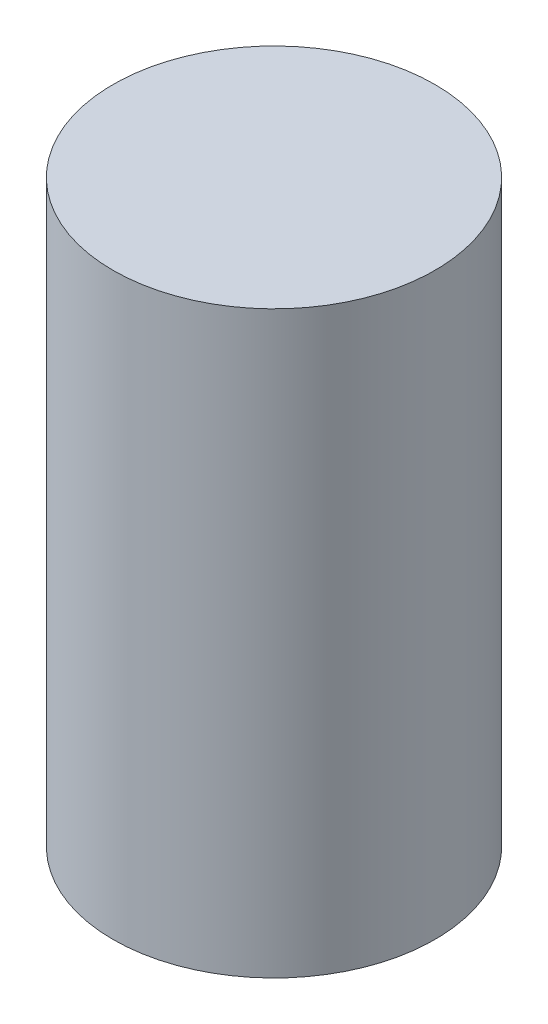
from build123d import *

# Parameters (mm, degrees)
SKETCH_1_R      = 15
EXTRUDE_1_DEPTH = 54


with BuildPart() as part:
    # 草图1 → 凸台-拉伸1 (new body)
    with BuildSketch(Plane(origin=(0, 0, 0), x_dir=(1, 0, 0), z_dir=(0, 1, 0))):
        with Locations(Location((0, 0, 0), (0, 0, 270))):
            Circle(SKETCH_1_R)
    extrude(amount=EXTRUDE_1_DEPTH)


solid = part.part
